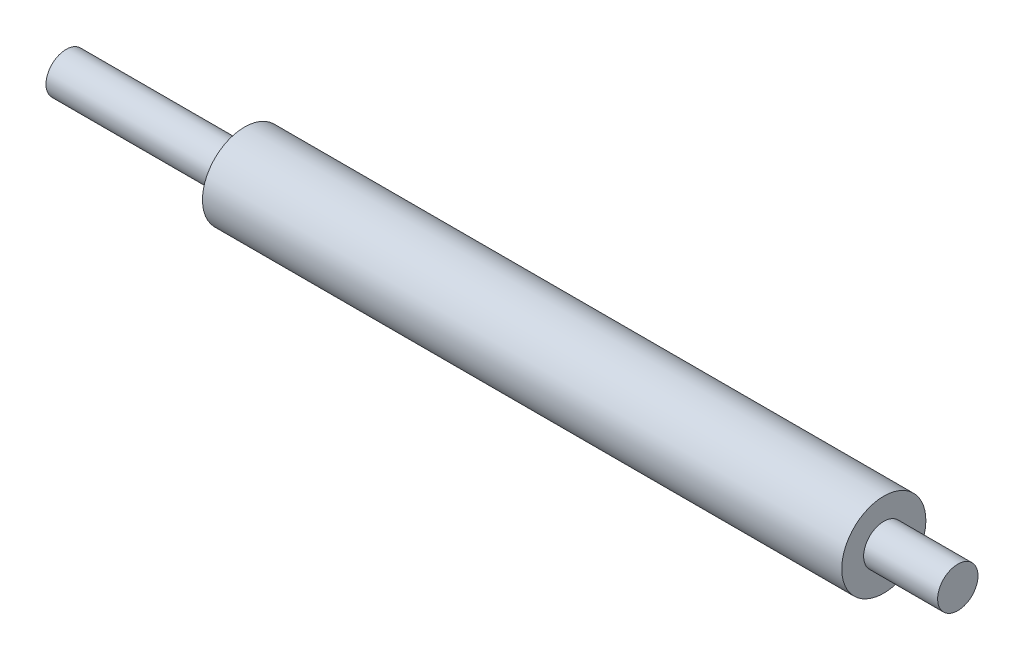
from build123d import *


with BuildPart() as part:
    # Sketch2 → Revolve1 (revolve)
    with BuildSketch(Plane.XY):
        Polygon((0, 0), (0, 6), (53, 6), (53, 12.5), (243, 12.5), (243, 6), (265, 6), (265, 0), align=None)
    revolve(axis=Axis((265, 0, 0), (-1, 0, 0)))


solid = part.part
